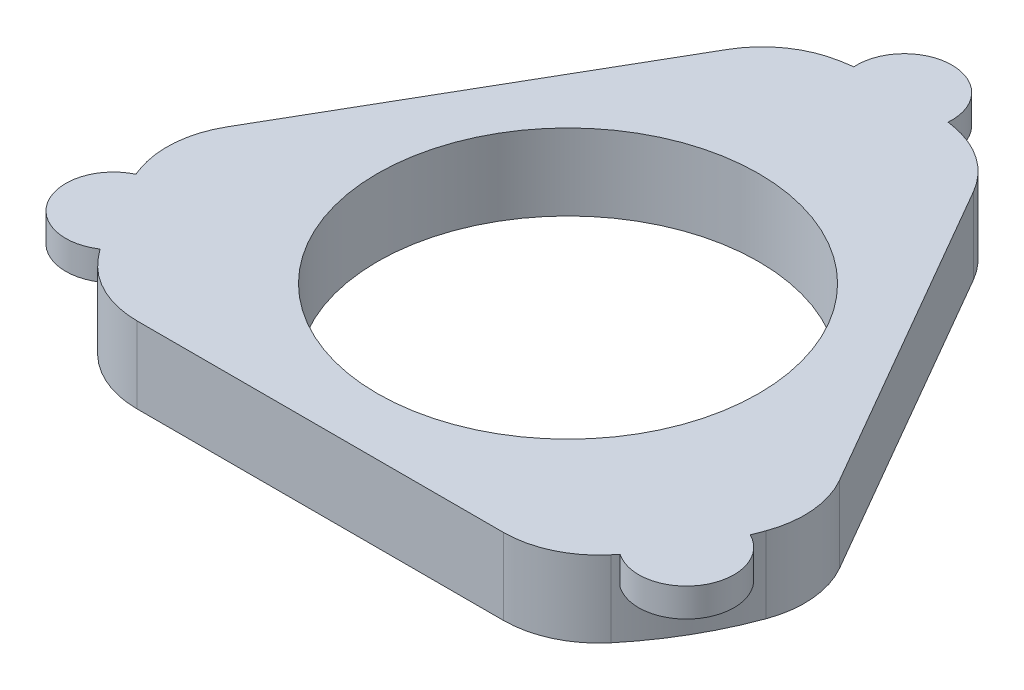
from build123d import *

# Parameters (mm, degrees)
SKETCH1_R                = 20
BOSS_EXTRUDE1_DEPTH      = 3.5
SKETCH2_R                = 35
SKETCH2_R_2              = 20
SKETCH2_R_3              = 2.8
BOSS_EXTRUDE2_DEPTH      = 8
BOSS_EXTRUDE3_DEPTH      = 2
BOSS_EXTRUDE3_DEPTH_BACK = 8
SKETCH4_R                = 2.9
SKETCH5_R                = 5
BOSS_EXTRUDE4_DEPTH      = 3
CUT_EXTRUDE1_START       = -10
SKETCH3_R                = 20
CUT_EXTRUDE1_DEPTH       = 10
SKETCH9_R                = 18.5
BOSS_EXTRUDE5_DEPTH      = 3.5
SKETCH10_R               = 18.5
SKETCH10_R_2             = 17.5
BOSS_EXTRUDE6_DEPTH      = 3.5
SKETCH11_W               = 2
SKETCH11_H               = 6.599117057
BOSS_EXTRUDE7_DEPTH      = 2
SKETCH12_R               = 72.135852014
CUT_EXTRUDE2_DEPTH       = 22
FILLET1_R                = 10
CUT_EXTRUDE3_START       = -10
SKETCH13_R               = 20
CUT_EXTRUDE3_DEPTH       = 10


with BuildPart() as part:
    # Sketch1 → Boss-Extrude1 (new body)
    with BuildSketch(Plane(origin=(0, 0, 0), x_dir=(1, 0, 0), z_dir=(0, 1, 0))):
        with Locations(Location((0, 0, 0), (0, 0, 270))):
            Circle(SKETCH1_R)
    extrude(amount=BOSS_EXTRUDE1_DEPTH)

    # Sketch2 → Boss-Extrude2 (add)
    with BuildSketch(Plane(origin=(0, 0, 0), x_dir=(1, 0, 0), z_dir=(0, 1, 0))):
        with Locations(Location((0, 0, 0), (0, 0, 270))):
            Circle(SKETCH2_R)
        with Locations(Location((0, 0, 0), (0, 0, 270))):
            Circle(SKETCH2_R_2, mode=Mode.SUBTRACT)
        with Locations(Location((0, 29, 0), (0, 0, 270))):
            Circle(SKETCH2_R_3, mode=Mode.SUBTRACT)
        with Locations(Location((25.11473671, -14.5, 0), (0, 0, 270))):
            Circle(SKETCH2_R_3, mode=Mode.SUBTRACT)
        with Locations(Location((-25.11473671, -14.5, 0), (0, 0, 270))):
            Circle(SKETCH2_R_3, mode=Mode.SUBTRACT)
    extrude(amount=BOSS_EXTRUDE2_DEPTH)

    # Sketch4 → Boss-Extrude3 (add, two sides: drawn at the far end of the back side and taken through both)
    with BuildSketch(Plane.XZ.offset(-BOSS_EXTRUDE3_DEPTH_BACK)):
        with Locations(Location((-25.11473671, 14.5, 0), (0, 0, 270))):
            Circle(SKETCH4_R)
        with Locations(Location((25.11473671, 14.5, 0), (0, 0, 270))):
            Circle(SKETCH4_R)
        with Locations(Location((0, -29, 0), (0, 0, 270))):
            Circle(SKETCH4_R)
    extrude(amount=BOSS_EXTRUDE3_DEPTH + BOSS_EXTRUDE3_DEPTH_BACK)

    # Sketch5 → Boss-Extrude4 (add)
    with BuildSketch(Plane(origin=(0, 8, 0), x_dir=(1, 0, 0), z_dir=(0, 1, 0))):
        with Locations((-30.453629482, -17.250404383)):
            Circle(SKETCH5_R)
        with Locations((0.28752632, 34.99881896)):
            Circle(SKETCH5_R)
        with Locations((30.166103162, -17.748414577)):
            Circle(SKETCH5_R)
    extrude(amount=-BOSS_EXTRUDE4_DEPTH)

    # Sketch3 → Cut-Extrude1 (cut)
    with BuildSketch(Plane(origin=(0, 3.5, 0), x_dir=(1, 0, 0), z_dir=(0, 1, 0)).offset(CUT_EXTRUDE1_START)):
        with Locations(Location((0, 0, 0), (0, 0, 270))):
            Circle(SKETCH3_R)
    extrude(amount=CUT_EXTRUDE1_DEPTH, mode=Mode.SUBTRACT)



with BuildPart() as body_2:
    # Sketch9 → Boss-Extrude5 (new body)
    with BuildSketch(Plane(origin=(0, 8, 0), x_dir=(1, 0, 0), z_dir=(0, 1, 0))):
        with Locations(Location((0, 0, 0), (0, 0, 270))):
            Circle(SKETCH9_R)
    extrude(amount=-BOSS_EXTRUDE5_DEPTH)

    # Sketch10 → Boss-Extrude6 (add)
    with BuildSketch(Plane(origin=(0, 4.5, 0), x_dir=(-1, 0, 0), z_dir=(0, -1, 0))):
        with Locations(Location((0, 0, 0), (0, 0, 270))):
            Circle(SKETCH10_R)
        with Locations(Location((0, 0, 0), (0, 0, 90))):
            Circle(SKETCH10_R_2, mode=Mode.SUBTRACT)
    extrude(amount=BOSS_EXTRUDE6_DEPTH)


with BuildPart() as part_1:
    add(part.part)

    add(body_2.part)  # Boss-Extrude7 merges body 2
    # Sketch11 → Boss-Extrude7 (add)
    with BuildSketch(Plane(origin=(0, 8, 0), x_dir=(1, 0, 0), z_dir=(0, 1, 0))):
        Polygon((19.946286756, -10.36129349), (14.231283742, -7.061734961), (13.231283742, -8.793785769), (18.946286756, -12.093344297), align=None)
        with Locations((0, 19.155079259)):
            Rectangle(SKETCH11_W, SKETCH11_H)
        Polygon((-18.946286756, -12.093344297), (-13.231283742, -8.793785769), (-14.231283742, -7.061734961), (-19.946286756, -10.36129349), align=None)
    extrude(amount=-BOSS_EXTRUDE7_DEPTH)

    # Sketch12 → Cut-Extrude2 (cut)
    with BuildSketch(Plane(origin=(0, 8, 0), x_dir=(1, 0, 0), z_dir=(0, 1, 0))):
        Circle(SKETCH12_R)
        Polygon((0, 52), (-45.033320997, -26), (45.033320997, -26), align=None, mode=Mode.SUBTRACT)
    extrude(amount=-CUT_EXTRUDE2_DEPTH, mode=Mode.SUBTRACT)

    # Fillet1
    fillet1_edges = [part_1.edges().sort_by_distance(p)[0] for p in [
        (34.232035012, 4, 7.291623888),
        (10.801285985, 4, -33.291623888),
        (-23.430749028, 4, 26),
        (23.430749028, 4, 26),
        (-10.801285985, 4, -33.291623888),
        (-34.232035012, 4, 7.291623888),
    ]]
    fillet(fillet1_edges, radius=FILLET1_R)

    # Sketch13 → Cut-Extrude3 (cut)
    with BuildSketch(Plane(origin=(0, 8, 0), x_dir=(1, 0, 0), z_dir=(0, 1, 0)).offset(CUT_EXTRUDE3_START)):
        with Locations(Location((0, 0, 0), (0, 0, 270))):
            Circle(SKETCH13_R)
    extrude(amount=CUT_EXTRUDE3_DEPTH, mode=Mode.SUBTRACT)


solid = part_1.part
